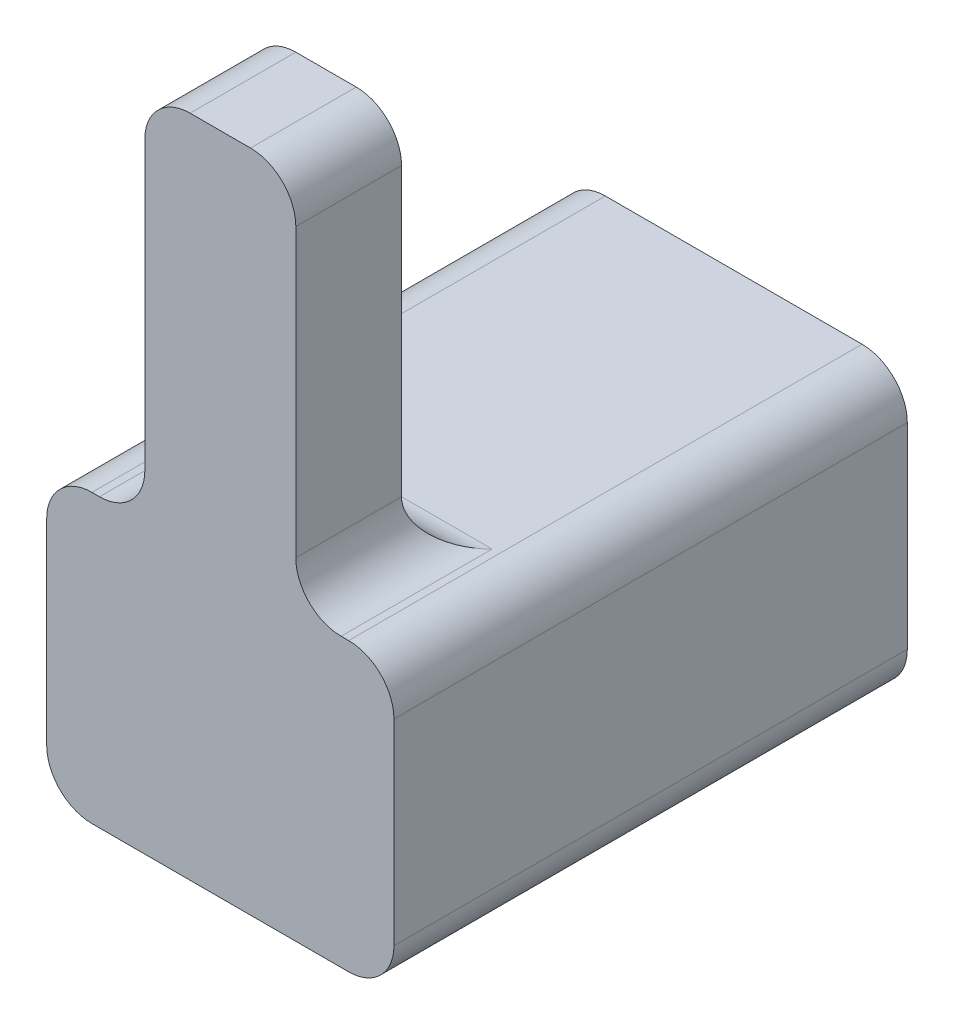
from build123d import *

# Parameters (mm, degrees)
SKETCH_1_W      = 23
SKETCH_1_H      = 19
EXTRUDE_1_DEPTH = 34
SKETCH_2_W      = 10
SKETCH_2_H      = 7
EXTRUDE_2_DEPTH = 25
FILLET_1_R      = 3


with BuildPart() as part:
    # 草图1 → 凸台-拉伸1 (new body)
    with BuildSketch(Plane.XY):
        Rectangle(SKETCH_1_W, SKETCH_1_H)
    extrude(amount=EXTRUDE_1_DEPTH)

    # 草图2 → 凸台-拉伸2 (add)
    with BuildSketch(Plane(origin=(0, 9.5, 0), x_dir=(1, 0, 0), z_dir=(0, 1, 0))):
        with Locations((0, -30.5)):
            Rectangle(SKETCH_2_W, SKETCH_2_H)
    extrude(amount=EXTRUDE_2_DEPTH)

    # 圆角1
    fillet_1_edges = [part.edges().sort_by_distance(p)[0] for p in [
        (11.5, -9.5, 17),
        (-11.5, -9.5, 17),
        (-11.5, 9.5, 17),
        (-5, 9.5, 30.5),
        (-5, 34.5, 30.5),
        (5, 34.5, 30.5),
        (5, 9.5, 30.5),
        (11.5, 9.5, 17),
        (0, 9.5, 27),
    ]]
    fillet(fillet_1_edges, radius=FILLET_1_R)


solid = part.part
